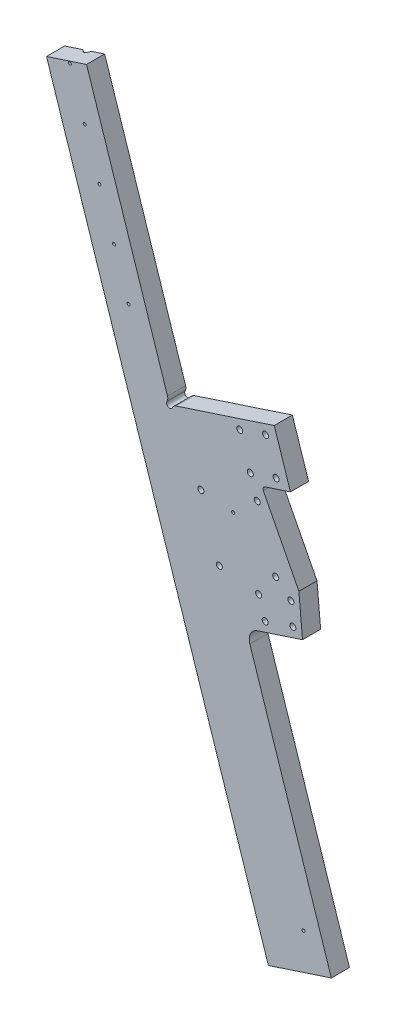
from build123d import *

# Parameters (mm, degrees)
BOSS_EXTRUDE1_DEPTH     = 19.05
BOSS_EXTRUDE2_DEPTH     = 19.05
FILLET1_R               = 3.175
FILLET2_R               = 12.7
CUT_EXTRUDE1_DEPTH      = 957.630297054
CUT_EXTRUDE1_DEPTH_BACK = 957.630297054
SKETCH47_R              = 3.175
FILLET4_R               = 6.35
F_0_25_DIAMETER_HOLE1_D = 6.35
HOLE6_D                 = 3.175
HOLE6_DEPTH             = 38.1
HOLE6_CSINK_D           = 10.16
HOLE6_CSINK_ANGLE       = 82
HOLE6_TIP               = 0.953866233
HOLE9_D                 = 3.175
HOLE9_DEPTH             = 57.15
HOLE9_CSINK_D           = 10.16
HOLE9_CSINK_ANGLE       = 82
HOLE9_TIP               = 0.953866233
HOLE15_D                = 3.175
HOLE15_DEPTH            = 31.75
HOLE15_CSINK_D          = 10.16
HOLE15_CSINK_ANGLE      = 82
HOLE15_TIP              = 0.953866233


with BuildPart() as part:
    # Sketch1 → Boss-Extrude1 (new body)
    with BuildSketch(Plane.XY):
        Polygon((-247.274665566, 82.142339986), (-313.471036221, 60.427634584), (-546.587167873, 771.072405964), (-504.525442447, 784.870110692), (-417.251419261, 518.818903446), (-393.116774032, 526.735904121), align=None)
    extrude(amount=-BOSS_EXTRUDE1_DEPTH)

    # Sketch2 → Boss-Extrude2 (add, through all)
    with BuildSketch(Plane.XY):
        Polygon((-393.116774032, 526.735904121), (-336.901176267, 355.36500697), (-277.604402796, 374.816405204), (-281.415155825, 417.005352091), (-320.44916939, 493.083731154), (-290.280862854, 502.979981998), (-307.307307279, 554.884385267), align=None)
    extrude(amount=-BOSS_EXTRUDE2_DEPTH)

    # Fillet1
    fillet1_edges = [part.edges().sort_by_distance(p)[0] for p in [
        (-320.44916939, 493.083731154, -9.525),
    ]]
    fillet(fillet1_edges, radius=FILLET1_R)

    # Fillet2
    fillet2_edges = [part.edges().sort_by_distance(p)[0] for p in [
        (-336.901176267, 355.36500697, -9.525),
    ]]
    fillet(fillet2_edges, radius=FILLET2_R)

    # Sketch47 → Cut-Extrude1 (cut, two sides: drawn at the far end of the back side and taken through both)
    with BuildSketch(Plane(origin=(0, 0, -19.05), x_dir=(-1, 0, 0), z_dir=(0, 0, -1)).offset(-CUT_EXTRUDE1_DEPTH_BACK)):
        with Locations((417.251419261, 518.818903446)):
            Circle(SKETCH47_R)
    extrude(amount=CUT_EXTRUDE1_DEPTH + CUT_EXTRUDE1_DEPTH_BACK, mode=Mode.SUBTRACT)

    # Fillet4
    fillet4_edges = [part.edges().sort_by_distance(p)[0] for p in [
        (-418.241044345, 521.8357341, -9.525),
        (-414.234588607, 519.80852853, -9.525),
    ]]
    fillet(fillet4_edges, radius=FILLET4_R)

    # 0.25_ Diameter Hole1 (through all)
    with Locations(Plane.XY):
        with Locations((-563.45033927, 698.544682362), (-504.072834209, 517.534843147), (-343.557230523, 532.968767209), (-316.40575464, 541.875392969), (-305.317060721, 508.071973621), (-332.468536604, 499.165347862), (-384.427899865, 457.805801818), (-325.157897499, 477.248418201), (-305.715281117, 417.978415836), (-364.985283482, 398.535799453), (-323.698740376, 393.110483865), (-289.824308357, 404.222472403), (-287.772364418, 381.505347156), (-316.771364786, 371.99266929)):
            Hole(F_0_25_DIAMETER_HOLE1_D / 2)

    # Hole6
    with Locations(Plane(origin=(308.428945222, -359.406503987, -19.05), x_dir=(-0.9977564584489054, 0.06694811142592419, 0), z_dir=(0, 0, -1))):
        with Locations((615.24080496, 429.781381762), (710.914924699, 391.126528253), (904.68821492, 1078.38439498), (976.811864753, 1049.244548945), (835.937309391, 717.51890547), (711.83598555, 767.659094962)):
            CounterSinkHole(HOLE6_D / 2, HOLE6_CSINK_D / 2, depth=HOLE6_DEPTH, counter_sink_angle=HOLE6_CSINK_ANGLE)
            with Locations((0, 0, -(HOLE6_DEPTH + HOLE6_TIP / 2))):  # 118° drill point
                Cone(0, HOLE6_D / 2, HOLE6_TIP, mode=Mode.SUBTRACT)

    # Hole9
    with Locations(Plane(origin=(308.428945222, -359.406503987, -38.1), x_dir=(-0.9977564584489054, 0.06694811142592419, 0), z_dir=(0, 0, -1))):
        with Locations((848.944412528, 940.413642522), (885.927448463, 1031.949868564), (867.435930496, 986.181755543), (830.452894561, 894.645529501)):
            CounterSinkHole(HOLE9_D / 2, HOLE9_CSINK_D / 2, depth=HOLE9_DEPTH, counter_sink_angle=HOLE9_CSINK_ANGLE)
            with Locations((0, 0, -(HOLE9_DEPTH + HOLE9_TIP / 2))):  # 118° drill point
                Cone(0, HOLE9_D / 2, HOLE9_TIP, mode=Mode.SUBTRACT)

    # Hole15
    with Locations(Plane(origin=(-146.812587105, -508.741515314, 72.024999997), x_dir=(0, 0, 1), z_dir=(-0.9501828830204603, -0.3116929399504042, -1.2203303954814629e-15))):
        with Locations((-78.374999997, 1293.039195846), (-78.374999997, 1121.589195846), (78.374999997, 1121.589195846), (78.374999997, 1293.039195846)):
            CounterSinkHole(HOLE15_D / 2, HOLE15_CSINK_D / 2, depth=HOLE15_DEPTH, counter_sink_angle=HOLE15_CSINK_ANGLE)
            with Locations((0, 0, -(HOLE15_DEPTH + HOLE15_TIP / 2))):  # 118° drill point
                Cone(0, HOLE15_D / 2, HOLE15_TIP, mode=Mode.SUBTRACT)


solid = part.part
